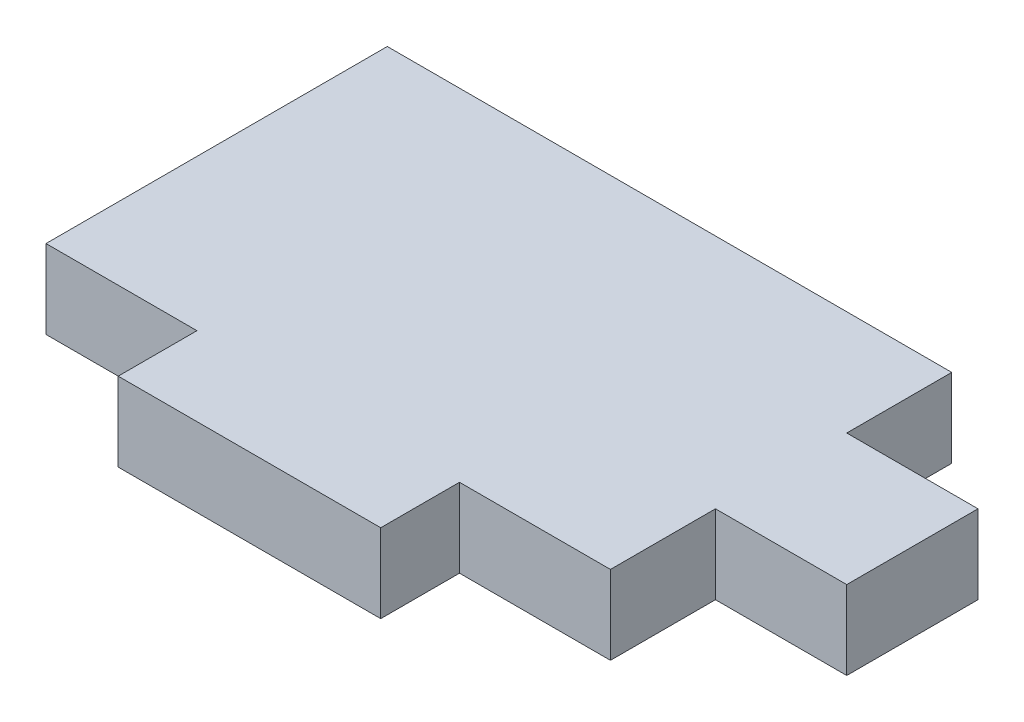
from build123d import *

# Parameters (mm, degrees)
BOSS_EXTRUDE1_DEPTH = 3


with BuildPart() as part:
    # Sketch1 → Boss-Extrude1 (new body)
    with BuildSketch(Plane(origin=(0, 0, 0), x_dir=(1, 0, 0), z_dir=(0, 1, 0))):
        Polygon((-15.75, 0), (-15.75, -3), (-5.75, -3), (-5.75, 0), (0, 0), (0, 4), (5, 4), (5, 9), (0, 9), (0, 13), (-21.5, 13), (-21.5, 0), align=None)
    extrude(amount=BOSS_EXTRUDE1_DEPTH)


solid = part.part
